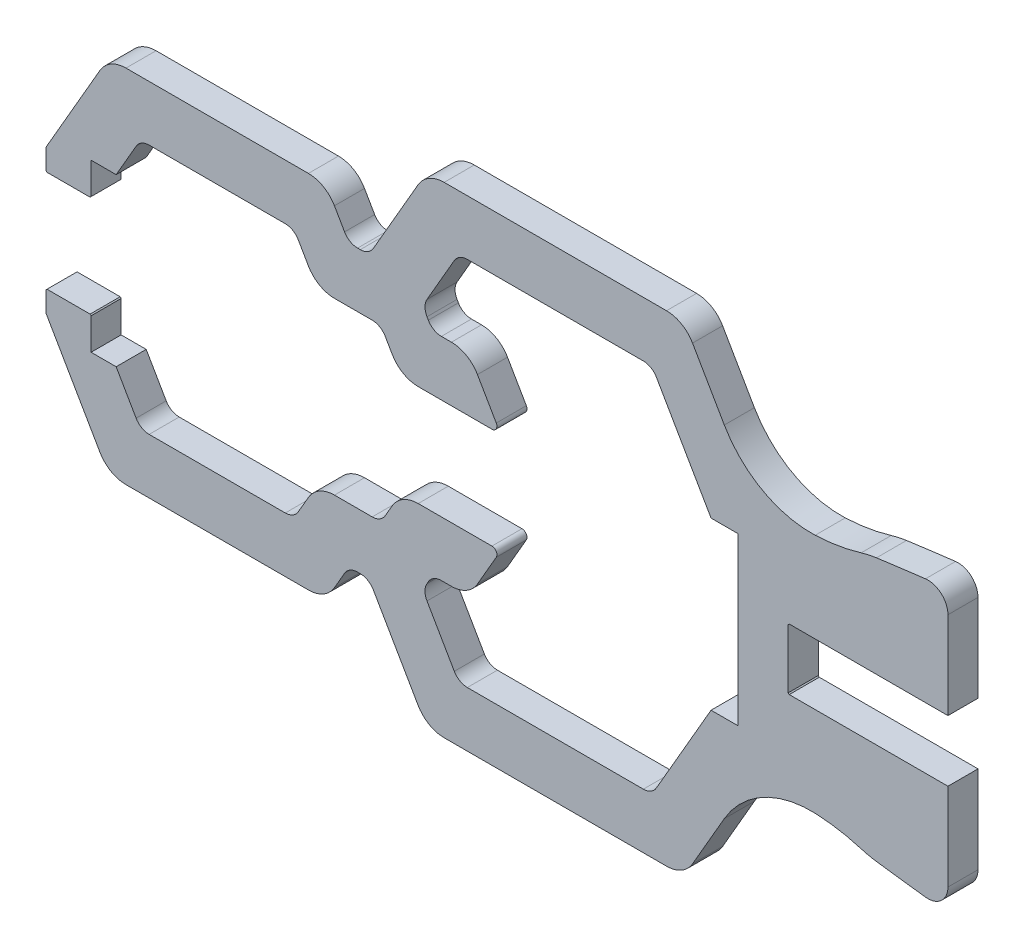
from build123d import *

# Parameters (mm, degrees)
EXTRUDE_1_DEPTH = 1.5
FILLET_4_R      = 10
FILLET_7_R      = 1.5
FILLET_8_R      = 3
CHAMFER_1_SIZE  = 0.1
FILLET_9_R      = 2
FILLET_10_R     = 0.5


with BuildPart() as part:
    # 草图1 → 凸台-拉伸1 (new, symmetric)
    with BuildSketch(Plane.XY):
        with BuildLine():
            Line((-130, 3.05), (-130, 14.015709242))
            ThreePointArc((-130, 14.015709242), (-134.003306479, 13.533897344), (-138, 13))
            ThreePointArc((-138, 13), (-144, 12.000000001), (-150, 13))
            Line((-150, 13), (-156.350852961, 24))
            Line((-156.350852961, 24), (-182, 24))
            Line((-182, 24), (-187.773502692, 14))
            Line((-187.773502692, 14), (-189.773502692, 14))
            Line((-189.773502692, 14), (-192.082903768, 18))
            Line((-192.082903768, 18), (-213.75055535, 18))
            Line((-213.75055535, 18), (-220, 7.175644347))
            Line((-220, 7.175644347), (-220, 5.05))
            Line((-220, 5.05), (-215.5, 5.05))
            Line((-215.5, 5.05), (-215.5, 8.3))
            Line((-215.5, 8.3), (-213, 8.3))
            Line((-213, 8.3), (-210.575128869, 12.5))
            Line((-210.575128869, 12.5), (-195.258330249, 12.5))
            Line((-195.258330249, 12.5), (-192.948929172, 8.5))
            Line((-192.948929172, 8.5), (-186.581793069, 8.5))
            Line((-186.581793069, 8.5), (-184.58993464, 5.05))
            Line((-184.58993464, 5.05), (-174.637306696, 5.05))
            Line((-174.637306696, 5.05), (-177.812733177, 10.55))
            Line((-177.812733177, 10.55), (-181.41450816, 10.55))
            Line((-181.41450816, 10.55), (-182.41450816, 12.282050807))
            Line((-182.41450816, 12.282050807), (-178.824573519, 18.5))
            Line((-178.824573519, 18.5), (-159.526279442, 18.5))
            Line((-159.526279442, 18.5), (-153.637306696, 8.3))
            Line((-153.637306696, 8.3), (-150.937306696, 8.3))
            Line((-150.937306696, 8.3), (-150.937306696, 3.05))
            Line((-150.937306696, 3.05), (-150.937306696, -3.05))
            Line((-150.937306696, -3.05), (-150.937306696, -8.3))
            Line((-150.937306696, -8.3), (-153.637306696, -8.3))
            Line((-153.637306696, -8.3), (-159.526279442, -18.5))
            Line((-159.526279442, -18.5), (-178.824573519, -18.5))
            Line((-178.824573519, -18.5), (-182.41450816, -12.282050807))
            Line((-182.41450816, -12.282050807), (-181.41450816, -10.55))
            Line((-181.41450816, -10.55), (-177.812733177, -10.55))
            Line((-177.812733177, -10.55), (-174.637306696, -5.05))
            Line((-174.637306696, -5.05), (-184.58993464, -5.05))
            Line((-184.58993464, -5.05), (-186.581793069, -8.5))
            Line((-186.581793069, -8.5), (-192.948929172, -8.5))
            Line((-192.948929172, -8.5), (-195.258330249, -12.5))
            Line((-195.258330249, -12.5), (-210.575128869, -12.5))
            Line((-210.575128869, -12.5), (-213, -8.3))
            Line((-213, -8.3), (-215.5, -8.3))
            Line((-215.5, -8.3), (-215.5, -5.05))
            Line((-215.5, -5.05), (-220, -5.05))
            Line((-220, -5.05), (-220, -7.175644347))
            Line((-220, -7.175644347), (-213.75055535, -18))
            Line((-213.75055535, -18), (-192.082903768, -18))
            Line((-192.082903768, -18), (-189.773502692, -14))
            Line((-189.773502692, -14), (-187.773502692, -14))
            Line((-187.773502692, -14), (-182, -24))
            Line((-182, -24), (-156.350852961, -24))
            Line((-156.350852961, -24), (-150, -13))
            ThreePointArc((-150, -13), (-144, -12), (-138, -13))
            ThreePointArc((-138, -13), (-134.003306479, -13.533897343), (-130, -14.015709241))
            Line((-130, -14.015709242), (-130, -3.05))
            Line((-130, -3.05), (-145.937306696, -3.05))
            Line((-145.937306696, -3.05), (-145.937306696, 3.05))
            Line((-145.937306696, 3.05), (-130, 3.05))
        make_face()
    extrude(amount=EXTRUDE_1_DEPTH, both=True)

    # 圆角4
    fillet_4_edges = [part.edges().sort_by_distance(p)[0] for p in [
        (-138, -13, 0),
        (-138, 13, 0),
        (-150, 13, 0),
        (-150, -13, 0),
    ]]
    fillet(fillet_4_edges, radius=FILLET_4_R)

    # 圆角7
    fillet_7_edges = [part.edges().sort_by_distance(p)[0] for p in [
        (-210.575128869, 12.5, 0),
        (-210.575128869, -12.5, 0),
        (-195.258330249, -12.5, 0),
        (-186.581793069, 8.5, 0),
        (-195.258330249, 12.5, 0),
        (-178.824573519, 18.5, 0),
        (-159.526279442, 18.5, 0),
        (-159.526279442, -18.5, 0),
        (-178.824573519, -18.5, 0),
        (-186.581793069, -8.5, 0),
        (-182.41450816, 12.282050807, 0),
        (-181.41450816, 10.55, 0),
        (-181.41450816, -10.55, 0),
        (-182.41450816, -12.282050807, 0),
        (-189.773502692, -14, 0),
        (-187.773502692, -14, 0),
        (-187.773502692, 14, 0),
        (-189.773502692, 14, 0),
    ]]
    fillet(fillet_7_edges, radius=FILLET_7_R)

    # 圆角8
    fillet_8_edges = [part.edges().sort_by_distance(p)[0] for p in [
        (-213.75055535, 18, 0),
        (-213.75055535, -18, 0),
        (-192.082903768, -18, 0),
        (-192.082903768, 18, 0),
        (-177.812733177, 10.55, 0),
        (-177.812733177, -10.55, 0),
        (-184.58993464, 5.05, 0),
        (-192.948929172, 8.5, 0),
        (-192.948929172, -8.5, 0),
        (-184.58993464, -5.05, 0),
        (-182, 24, 0),
        (-156.350852961, 24, 0),
        (-156.350852961, -24, 0),
        (-182, -24, 0),
    ]]
    fillet(fillet_8_edges, radius=FILLET_8_R)

    # 倒角1
    chamfer_1_edges = [part.edges().sort_by_distance(p)[0] for p in [
        (-145.937306696, -3.05, 0),
        (-145.937306696, 3.05, 0),
        (-220, -5.05, 0),
        (-215.5, -5.05, 0),
        (-220, 5.05, 0),
        (-215.5, 5.05, 0),
    ]]
    chamfer(chamfer_1_edges, length=CHAMFER_1_SIZE)

    # 圆角9
    fillet_9_edges = [part.edges().sort_by_distance(p)[0] for p in [
        (-130, -14.015709241, 0),
        (-130, 14.015709242, 0),
    ]]
    fillet(fillet_9_edges, radius=FILLET_9_R)

    # 圆角10
    fillet_10_edges = [part.edges().sort_by_distance(p)[0] for p in [
        (-174.637306696, -5.05, 0),
        (-174.637306696, 5.05, 0),
    ]]
    fillet(fillet_10_edges, radius=FILLET_10_R)


solid = part.part
